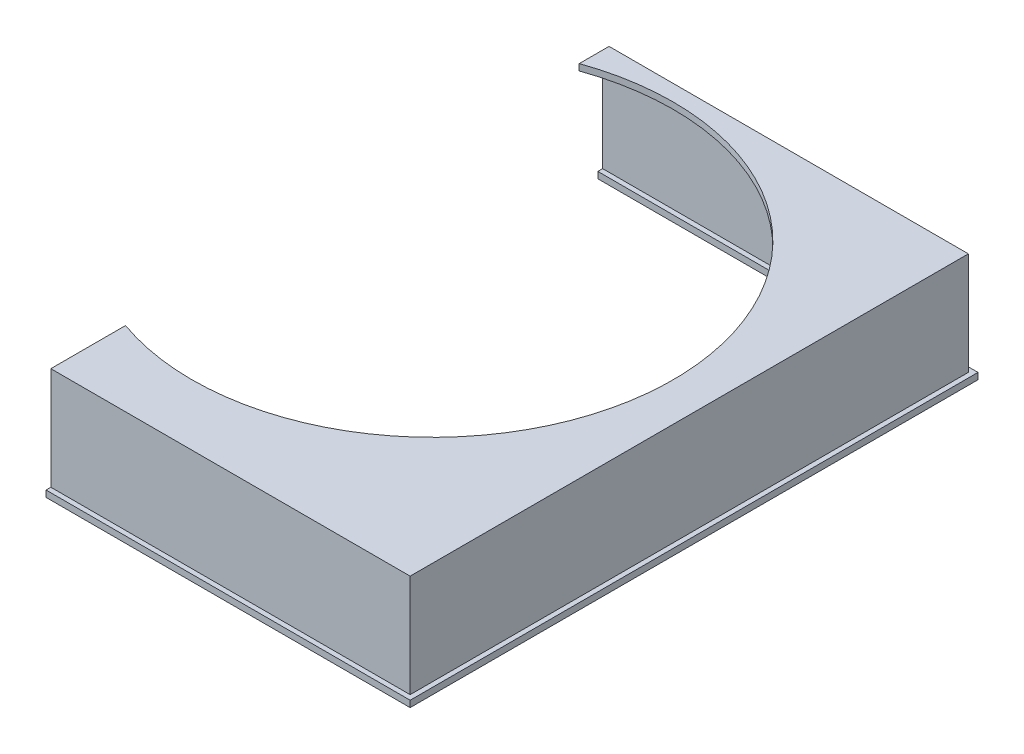
from build123d import *

# Parameters (mm, degrees)
SKETCH_1_W          = 224
SKETCH_1_H          = 174
SKETCH_1_W_2        = 220
SKETCH_1_H_2        = 170
EXTRUDE_1_DEPTH     = 32
SKETCH_2_W          = 227
SKETCH_2_H          = 177
SKETCH_2_W_2        = 217
SKETCH_2_H_2        = 167
EXTRUDE_2_DEPTH     = 2
SKETCH_3_W          = 222
SKETCH_3_H          = 172
SKETCH_3_R          = 75
EXTRUDE_3_DEPTH     = 2
SKETCH_4_W          = 113.5
SKETCH_4_H          = 177
CUT_EXTRUDE_1_DEPTH = 285.974560268


with BuildPart() as part:
    # 草图1 → 凸台-拉伸1 (new body)
    with BuildSketch(Plane(origin=(0, 0, 0), x_dir=(1, 0, 0), z_dir=(0, 1, 0))):
        with Locations((110, -85)):
            Rectangle(SKETCH_1_W, SKETCH_1_H)
        with Locations((110, -85)):
            Rectangle(SKETCH_1_W_2, SKETCH_1_H_2, mode=Mode.SUBTRACT)
    extrude(amount=EXTRUDE_1_DEPTH)

    # 草图2 → 凸台-拉伸2 (add)
    with BuildSketch(Plane(origin=(0, 0, 0), x_dir=(1, 0, 0), z_dir=(0, 1, 0))):
        with Locations((110, -85)):
            Rectangle(SKETCH_2_W, SKETCH_2_H)
        with Locations((110, -85)):
            Rectangle(SKETCH_2_W_2, SKETCH_2_H_2, mode=Mode.SUBTRACT)
    extrude(amount=-EXTRUDE_2_DEPTH)

    # 草图3 → 凸台-拉伸3 (add)
    with BuildSketch(Plane(origin=(0, 32, 0), x_dir=(1, 0, 0), z_dir=(0, 1, 0))):
        with Locations((109, -84)):
            Rectangle(SKETCH_3_W, SKETCH_3_H)
        with Locations(Location((135, -78, 0), (0, 0, 270))):
            Circle(SKETCH_3_R, mode=Mode.SUBTRACT)
    extrude(amount=-EXTRUDE_3_DEPTH)

    # 草图4 → 切除-拉伸1 (cut, through all)
    with BuildSketch(Plane(origin=(0, 32, 0), x_dir=(1, 0, 0), z_dir=(0, 1, 0))):
        with Locations((53.25, -85)):
            Rectangle(SKETCH_4_W, SKETCH_4_H)
    extrude(amount=-CUT_EXTRUDE_1_DEPTH, mode=Mode.SUBTRACT)


solid = part.part
